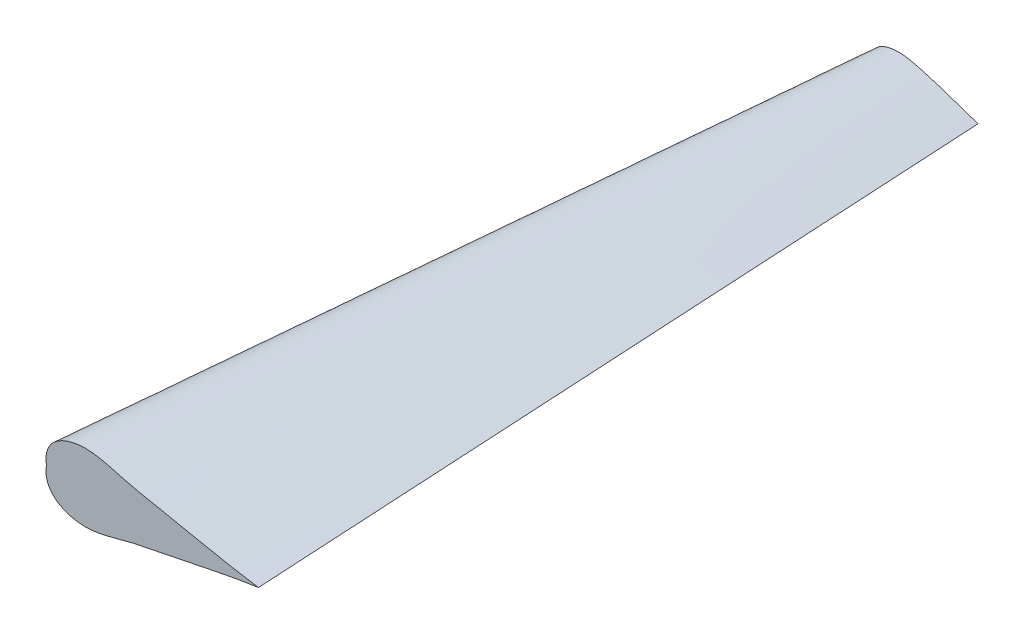
from build123d import *


with BuildPart() as part:
    # Sketch2 → Loft1 section 0
    with BuildSketch(Plane.XY):
        with BuildLine():
            add(Edge.make_bspline(
                [(168.188579312, 77.384362157), (164.657243592, 99.467764369), (197.150828079, 113.665311422), (252.932096047, 100.527778681), (291.050772217, 86.738154927), (318.188579312, 77.384362157)],
                knots=[0, 0, 0, 0, 0.300097882, 0.498607648, 1, 1, 1, 1], degree=3))
            add(Edge.make_bspline(
                [(168.188579312, 77.384362157), (164.657243592, 55.300959944), (197.150828079, 41.103412892), (252.932096047, 54.240945633), (291.050772217, 68.030569387), (318.188579312, 77.384362157)],
                knots=[0, 0, 0, 0, 0.300097882, 0.498607648, 1, 1, 1, 1], degree=3))
        make_face()
    # Sketch1 → Loft1 section 1
    with BuildSketch(Plane.XY.offset(1000)):
        with BuildLine():
            add(Edge.make_bspline(
                [(0, 0), (-5.374691187, 30.89835065), (46.733417697, 58.782828285), (105.349466996, 37.100435312), (189.501798099, 21.488683268), (251.04867967, 7.102791391), (300, 0)],
                knots=[0, 0, 0, 0, 0.224641108, 0.429840549, 0.552694137, 1, 1, 1, 1], degree=3))
            add(Edge.make_bspline(
                [(0, 0), (-5.374691187, -30.89835065), (46.733417697, -58.782828285), (105.349466996, -37.100435312), (189.501798099, -21.488683268), (251.04867967, -7.102791391), (300, 0)],
                knots=[0, 0, 0, 0, 0.224641108, 0.429840549, 0.552694137, 1, 1, 1, 1], degree=3))
        make_face()
    loft()


solid = part.part
